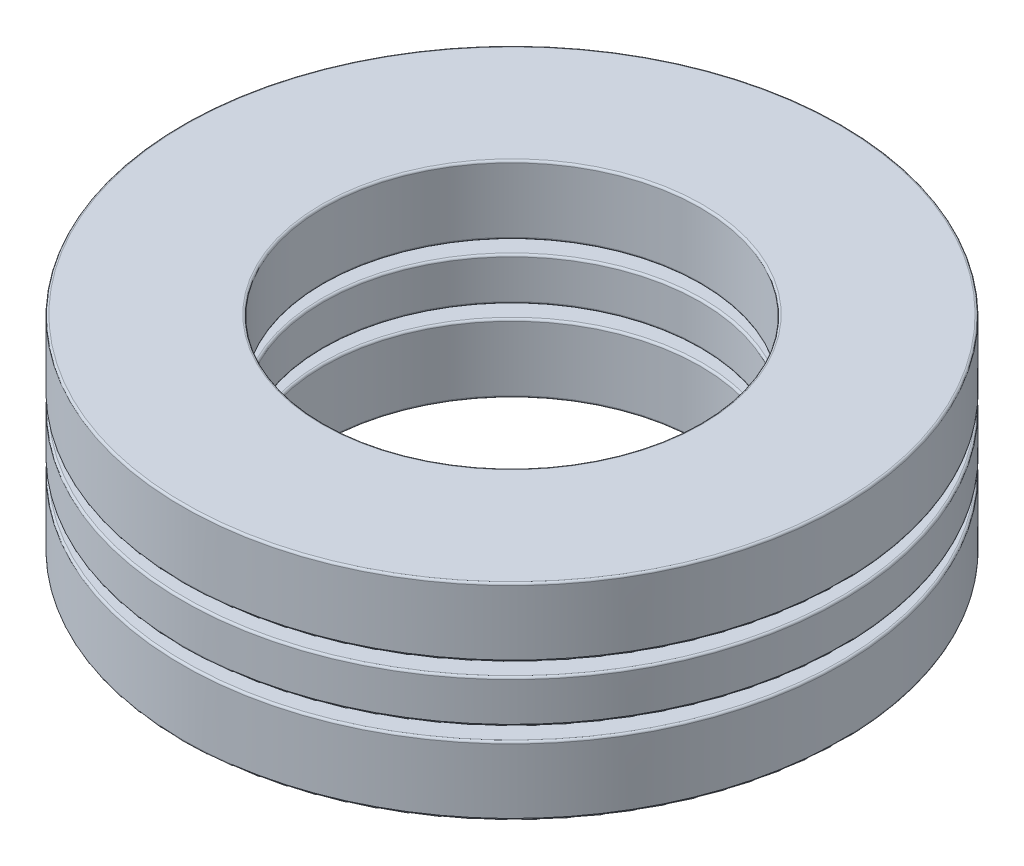
from build123d import *

# Parameters (mm, degrees)
SKETCH1_W         = 6
SKETCH1_H         = 1.820833334
CIRPATTERN1_COUNT = 7
CIRPATTERN1_ANGLE = 308.571428571
CIRPATTERN2_COUNT = 7
SKETCH4_W         = 6
SKETCH4_H         = 2.913333333
FILLET1_R         = 0.0874
FILLET2_R         = 0.0874
FILLET3_R         = 0.0874


with BuildPart() as part:
    # Sketch1 → Revolve1 (revolve)
    with BuildSketch(Plane(origin=(0, 0, 0), x_dir=(0, 0, -1), z_dir=(1, 0, 0)), mode=Mode.PRIVATE) as revolve1_sk:
        with Locations((-11, 0)):
            Rectangle(SKETCH1_W, SKETCH1_H)
    revolve(revolve1_sk.sketch.rotate(Axis((0, -4.37, 0), (0, 1, 0)), 180), axis=Axis((0, -4.37, 0), (0, 1, 0)))

    # Sketch3 → Cut-Revolve1 (revolve, cut)
    with BuildSketch(Plane(origin=(0, 0, 0), x_dir=(0, 0, -1), z_dir=(1, 0, 0))):
        with BuildLine():
            Line((-11, 1.456666667), (-11, -1.456666667))
            ThreePointArc((-11, -1.456666667), (-12.456666667, 0), (-11, 1.456666667))
        make_face()
    cut_revolve1 = revolve(axis=Axis((0, 1.456666667, 11), (0, -1, 0)), mode=Mode.SUBTRACT)

    # CirPattern2: Cut-Revolve1 ×7 about axis
    cirpattern2_axis = Axis((0, 0, 0), (0, 1, 0))
    for i in range(1, CIRPATTERN2_COUNT):
        add(cut_revolve1.rotate(cirpattern2_axis, i * 360 / CIRPATTERN2_COUNT), mode=Mode.SUBTRACT)

    # Fillet2
    fillet2_edges = [part.edges().sort_by_distance(p)[0] for p in [
        (0, 0.910416667, 14),
        (0, 0.910416667, 8),
        (0, -0.910416667, 8),
        (0, -0.910416667, 14),
    ]]
    fillet(fillet2_edges, radius=FILLET2_R)


with BuildPart() as body_2:
    # Sketch2 → Revolve2 (revolve)
    with BuildSketch(Plane(origin=(0, 0, 0), x_dir=(0, 0, -1), z_dir=(1, 0, 0))):
        with BuildLine():
            Line((-11, 1.456666667), (-11, -1.456666667))
            ThreePointArc((-11, -1.456666667), (-12.456666667, 0), (-11, 1.456666667))
        make_face()
    revolve(axis=Axis((0, 1.456666667, 11), (0, -1, 0)))


with BuildPart() as cirpattern1_1:
    # CirPattern1: pattern copy
    add(body_2.part.rotate(Axis((0, 4.37, 0), (0, -1, 0)), 1 * CIRPATTERN1_ANGLE / (CIRPATTERN1_COUNT - 1)))


with BuildPart() as cirpattern1_2:
    # CirPattern1: pattern copy
    add(body_2.part.rotate(Axis((0, 4.37, 0), (0, -1, 0)), 2 * CIRPATTERN1_ANGLE / (CIRPATTERN1_COUNT - 1)))


with BuildPart() as cirpattern1_3:
    # CirPattern1: pattern copy
    add(body_2.part.rotate(Axis((0, 4.37, 0), (0, -1, 0)), 3 * CIRPATTERN1_ANGLE / (CIRPATTERN1_COUNT - 1)))


with BuildPart() as cirpattern1_4:
    # CirPattern1: pattern copy
    add(body_2.part.rotate(Axis((0, 4.37, 0), (0, -1, 0)), 4 * CIRPATTERN1_ANGLE / (CIRPATTERN1_COUNT - 1)))


with BuildPart() as cirpattern1_5:
    # CirPattern1: pattern copy
    add(body_2.part.rotate(Axis((0, 4.37, 0), (0, -1, 0)), 5 * CIRPATTERN1_ANGLE / (CIRPATTERN1_COUNT - 1)))


with BuildPart() as cirpattern1_6:
    # CirPattern1: pattern copy
    add(body_2.part.rotate(Axis((0, 4.37, 0), (0, -1, 0)), 6 * CIRPATTERN1_ANGLE / (CIRPATTERN1_COUNT - 1)))


with BuildPart() as body_9:
    # Sketch4 → Revolve3 (revolve)
    with BuildSketch(Plane(origin=(0, 0, 0), x_dir=(0, 0, -1), z_dir=(1, 0, 0)), mode=Mode.PRIVATE) as revolve3_sk:
        with Locations((-11, 2.913333334)):
            Rectangle(SKETCH4_W, SKETCH4_H)
        with Locations((-11, -2.913333334)):
            Rectangle(SKETCH4_W, SKETCH4_H)
    revolve(revolve3_sk.sketch.rotate(Axis((0, -4.37, 0), (0, 1, 0)), 180), axis=Axis((0, -4.37, 0), (0, 1, 0)))

    # Fillet1
    fillet1_edges = [body_9.edges().sort_by_distance(p)[0] for p in [
        (0, 1.456666667, 14),
        (0, 1.456666667, 8),
        (0, 4.37, 8),
        (0, 4.37, 14),
    ]]
    fillet(fillet1_edges, radius=FILLET1_R)

    # Fillet3
    fillet3_edges = [body_9.edges().sort_by_distance(p)[0] for p in [
        (0, -4.37, 14),
        (0, -4.37, 8),
        (0, -1.456666667, 8),
        (0, -1.456666667, 14),
    ]]
    fillet(fillet3_edges, radius=FILLET3_R)


solid = Compound([part.part, body_2.part, cirpattern1_1.part, cirpattern1_2.part, cirpattern1_3.part, cirpattern1_4.part, cirpattern1_5.part, cirpattern1_6.part, body_9.part])
